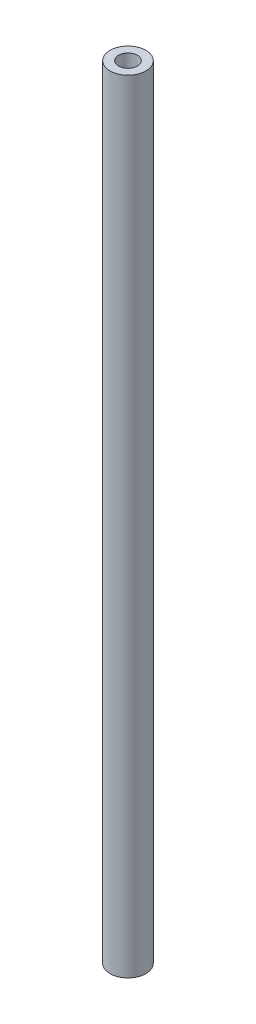
from build123d import *

# Parameters (mm, degrees)
SKETCH1_R           = 0.3207
SKETCH1_R_2         = 0.1685
BOSS_EXTRUDE1_DEPTH = 14


with BuildPart() as part:
    # Sketch1 → Boss-Extrude1 (new body)
    with BuildSketch(Plane(origin=(0, 0, 0), x_dir=(1, 0, 0), z_dir=(0, 1, 0))):
        with Locations(Location((0, 0, 0), (0, 0, 270))):
            Circle(SKETCH1_R)
        with Locations(Location((0, 0, 0), (0, 0, 270))):
            Circle(SKETCH1_R_2, mode=Mode.SUBTRACT)
    extrude(amount=BOSS_EXTRUDE1_DEPTH)


solid = part.part
